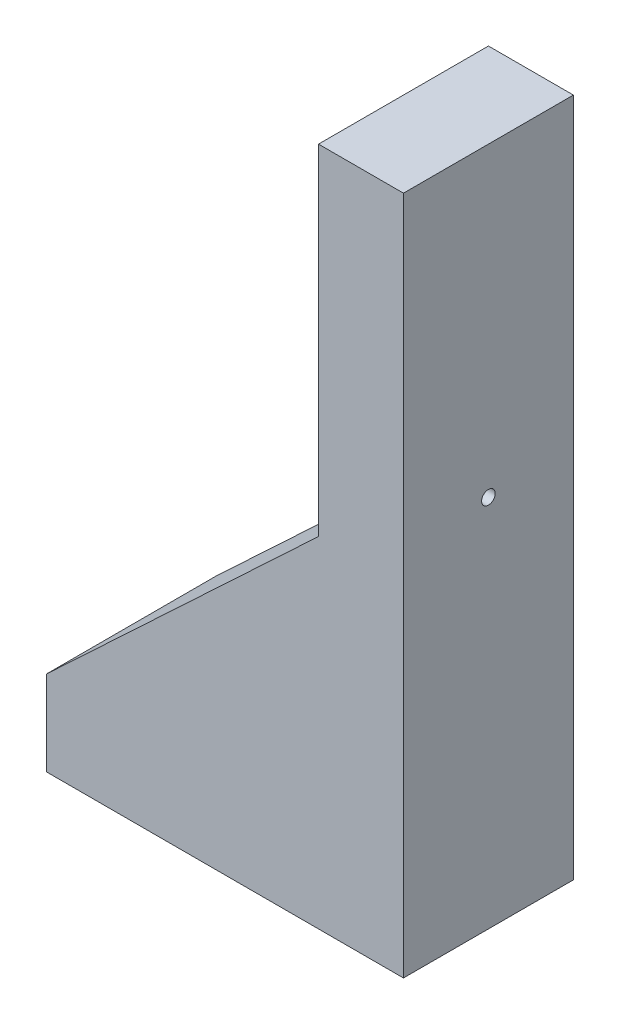
from build123d import *

# Parameters (mm, degrees)
BOSS_EXTRUDE1_DEPTH = 50
SKETCH2_R           = 2
CUT_EXTRUDE1_DEPTH  = 25


with BuildPart() as part:
    # Sketch1 → Boss-Extrude1 (new body)
    with BuildSketch(Plane.XY):
        Polygon((0, 97.819314642), (0, -102.180685358), (-105, -102.180685358), (-105, -77.180685358), (-25, -2.180685358), (-25, 97.819314642), align=None)
    extrude(amount=BOSS_EXTRUDE1_DEPTH)

    # Sketch2 → Cut-Extrude1 (cut)
    with BuildSketch(Plane(origin=(0, 0, 0), x_dir=(0, 0, -1), z_dir=(1, 0, 0))):
        with Locations((-25, 7.819314642)):
            Circle(SKETCH2_R)
    extrude(amount=-CUT_EXTRUDE1_DEPTH, mode=Mode.SUBTRACT)


solid = part.part
